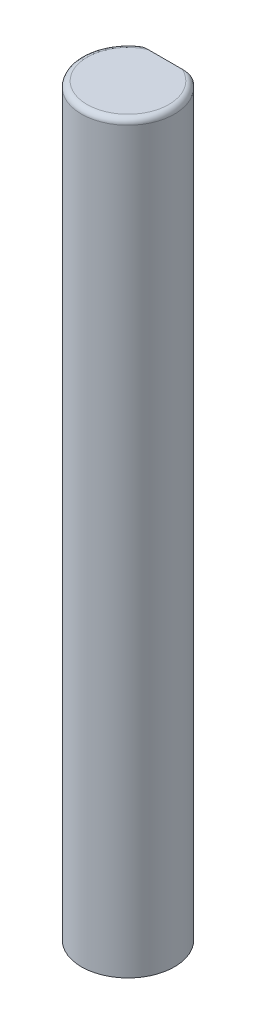
from build123d import *

# Parameters (mm, degrees)
SKETCH1_R           = 2.5
BOSS_EXTRUDE1_DEPTH = 40
SKETCH2_W           = 8.231649798
SKETCH2_H           = 2.477236303
CUT_EXTRUDE1_DEPTH  = 18
FILLET1_R           = 0.3


with BuildPart() as part:
    # Sketch1 → Boss-Extrude1 (new body)
    with BuildSketch(Plane(origin=(0, 0, 0), x_dir=(1, 0, 0), z_dir=(0, 1, 0))):
        with Locations(Location((0, 0, 0), (0, 0, 270))):
            Circle(SKETCH1_R)
    extrude(amount=BOSS_EXTRUDE1_DEPTH)

    # Sketch2 → Cut-Extrude1 (cut)
    with BuildSketch(Plane(origin=(0, 40, 0), x_dir=(1, 0, 0), z_dir=(0, 1, 0))):
        with Locations((-0.064511362, 3.238618152)):
            Rectangle(SKETCH2_W, SKETCH2_H)
    extrude(amount=-CUT_EXTRUDE1_DEPTH, mode=Mode.SUBTRACT)

    # Fillet1
    fillet1_edges = [part.edges().sort_by_distance(p)[0] for p in [
        (2.371708245, 40, 0.790569415),
    ]]
    fillet(fillet1_edges, radius=FILLET1_R)


solid = part.part
